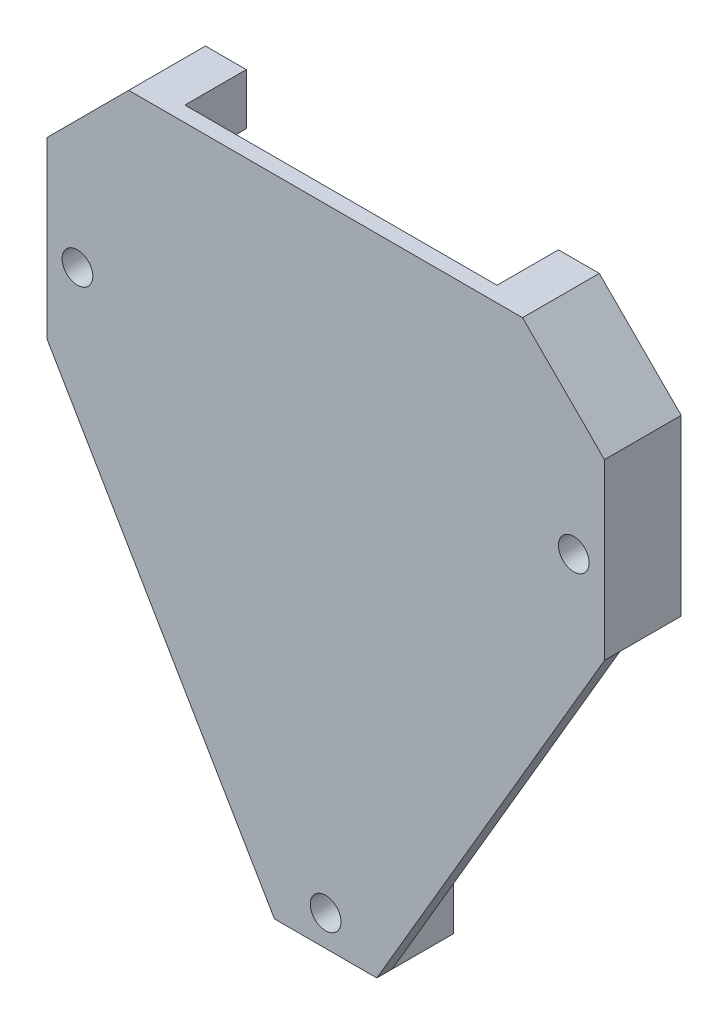
from build123d import *

# Parameters (mm, degrees)
SKETCH_1_R        = 1.5
EXTRUDE_1_DEPTH   = 6
EXTRUDE_1_2_DEPTH = 6
SKETCH_1_W        = 10
SKETCH_1_H        = 7
EXTRUDE_1_3_DEPTH = 6
SKETCH_2_R        = 1.5
EXTRUDE_2_DEPTH   = 1.5
SKETCH_3_R        = 1
EXTRUDE_3_DEPTH   = 1.5


with BuildPart() as part:
    # Эскиз1 → Бобышка-Вытянуть1 (new body)
    with BuildSketch(Plane.XY):
        Polygon((39.75, 326), (39.75, 321), (35, 321), (35, 301), (27.75, 301), (27.75, 317.992640687), (35.757359313, 326), align=None)
        with Locations((30.75, 308.5)):
            Circle(SKETCH_1_R, mode=Mode.SUBTRACT)
    extrude(amount=EXTRUDE_1_DEPTH)



with BuildPart() as body_2:
    # Эскиз1 → Extrude 1 2 (new body)
    with BuildSketch(Plane.XY):
        Polygon((82.25, 301), (75, 301), (75, 321), (70.25, 321), (70.25, 326), (74.242640687, 326), (82.25, 317.992640687), align=None)
        with Locations((79.25, 308.5)):
            Circle(SKETCH_1_R, mode=Mode.SUBTRACT)
    extrude(amount=EXTRUDE_1_2_DEPTH)


with BuildPart() as body_3:
    # Эскиз1 → Extrude 1 3 (new body)
    with BuildSketch(Plane.XY):
        with Locations((55, 266.5)):
            Rectangle(SKETCH_1_W, SKETCH_1_H)
        with Locations((55, 266)):
            Circle(SKETCH_1_R, mode=Mode.SUBTRACT)
    extrude(amount=EXTRUDE_1_3_DEPTH)


with BuildPart() as part_1:
    add(part.part)

    add(body_2.part)  # Бобышка-Вытянуть2 merges body 2

    add(body_3.part)  # Бобышка-Вытянуть2 merges body 3
    # Эскиз2 → Бобышка-Вытянуть2 (add)
    with BuildSketch(Plane.XY.offset(6)):
        Polygon((82.25, 301), (82.25, 317.992640687), (74.242640687, 326), (70.25, 326), (39.75, 326), (35.757359313, 326), (27.75, 317.992640687), (27.75, 301), (50, 263), (60, 263), align=None)
        with Locations((55, 266)):
            Circle(SKETCH_2_R, mode=Mode.SUBTRACT)
        with Locations((79.25, 308.5)):
            Circle(SKETCH_2_R, mode=Mode.SUBTRACT)
        with Locations((30.75, 308.5)):
            Circle(SKETCH_2_R, mode=Mode.SUBTRACT)
    extrude(amount=EXTRUDE_2_DEPTH)

    # Эскиз3 → Бобышка-Вытянуть3 (add)
    with BuildSketch(Plane(origin=(0, 270, 0), x_dir=(1, 0, 0), z_dir=(0, 1, 0))):
        with Locations(Location((55, -3.5, 0), (0, 0, 90))):
            Circle(SKETCH_3_R)
    extrude(amount=EXTRUDE_3_DEPTH)


solid = part_1.part
